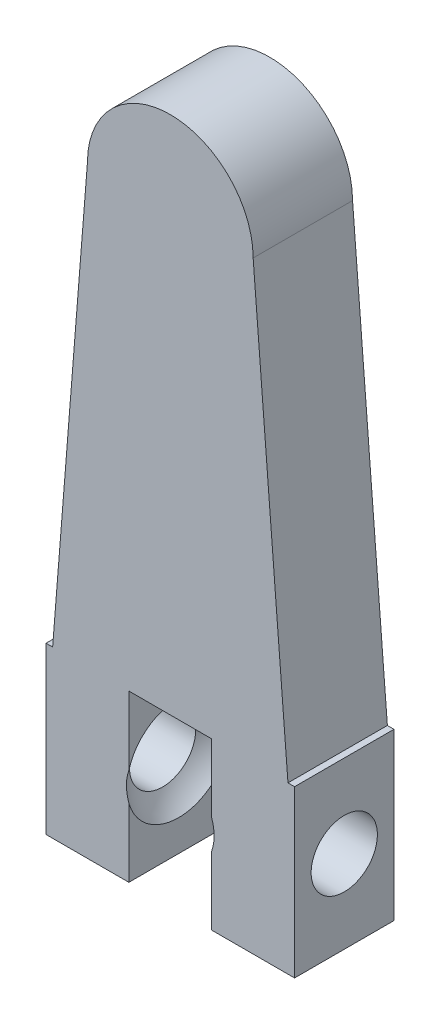
from build123d import *

# Parameters (mm, degrees)
SALIENTE_EXTRUIR1_DEPTH = 6
CROQUIS4_R              = 2
CORTAR_EXTRUIR1_DEPTH   = 15


with BuildPart() as part:
    # Croquis1 → Saliente-Extruir1 (new body)
    with BuildSketch(Plane.XY):
        with BuildLine():
            Line((7.5, -36.38301994), (2.5, -36.38301994))
            Line((2.5, -36.38301994), (2.5, -26.38301994))
            Line((2.5, -26.38301994), (-2.5, -26.38301994))
            Line((-2.5, -26.38301994), (-2.5, -36.38301994))
            Line((-2.5, -36.38301994), (-7.5, -36.38301994))
            Line((-7.5, -36.38301994), (-7.5, -26.38301994))
            Line((-7.5, -26.38301994), (-7.101695438, -26.38301994))
            Line((-7.101695438, -26.38301994), (-5, 0))
            ThreePointArc((-5, 0), (0, 5), (5, 0))
            Line((5, 0), (7.101695438, -26.38301994))
            Line((7.101695438, -26.38301994), (7.5, -26.38301994))
            Line((7.5, -26.38301994), (7.5, -36.38301994))
        make_face()
    extrude(amount=SALIENTE_EXTRUIR1_DEPTH)

    # Croquis2 → Cortar-Revolución1 (revolve, cut)
    with BuildSketch(Plane(origin=(0, 0, 0), x_dir=(0, 0, -1), z_dir=(1, 0, 0))):
        with BuildLine():
            Line((3, 0), (-5, 0))
            ThreePointArc((-5, 0), (-1, 4), (3, 0))
        make_face()
    revolve(axis=Axis((0, 0, -3), (0, 0, 1)), mode=Mode.SUBTRACT)

    # Croquis4 → Cortar-Extruir1 (cut)
    with BuildSketch(Plane(origin=(7.5, 0, 0), x_dir=(0, 0, -1), z_dir=(1, 0, 0))):
        with Locations((-3, -31.38301994)):
            Circle(CROQUIS4_R)
    extrude(amount=-CORTAR_EXTRUIR1_DEPTH, mode=Mode.SUBTRACT)

    # Croquis5 → Cortar-Revolución2 (revolve, cut)
    with BuildSketch(Plane(origin=(0, 0, 0), x_dir=(0, 0, -1), z_dir=(1, 0, 0))):
        with BuildLine():
            Line((-7, -31.38301994), (1, -31.38301994))
            ThreePointArc((1, -31.38301994), (-3, -27.38301994), (-7, -31.38301994))
        make_face()
    revolve(axis=Axis((0, -31.38301994, 7), (0, 0, -1)), mode=Mode.SUBTRACT)


solid = part.part
